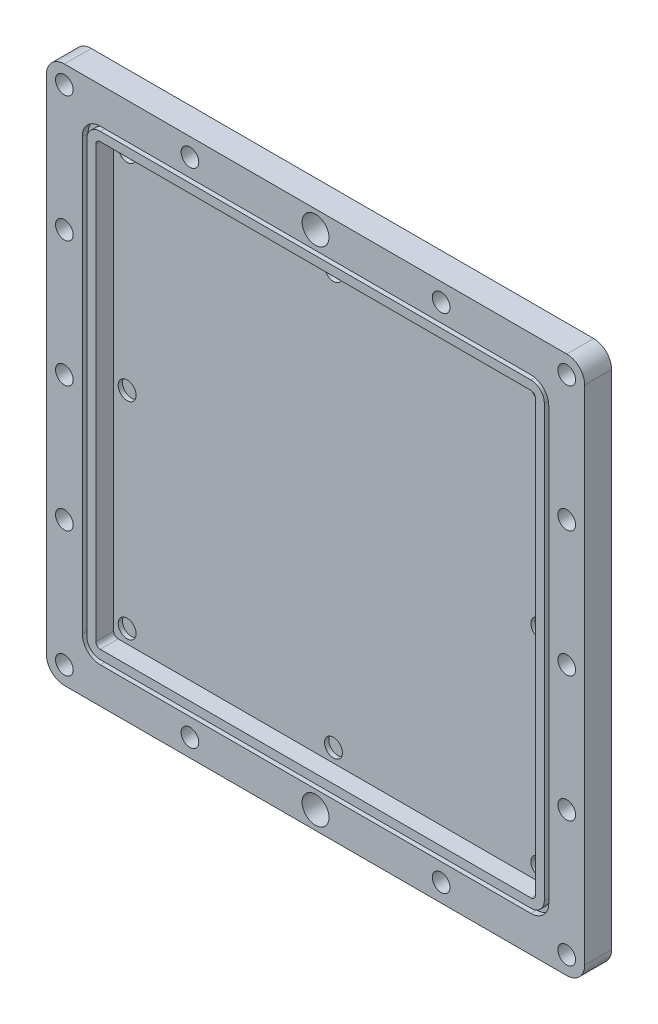
from build123d import *

# Parameters (mm, degrees)
SKETCH1_W           = 190.5
SKETCH1_H           = 190.5
BOSS_EXTRUDE1_DEPTH = 9.525
SKETCH4_R           = 3.1242
CUT_EXTRUDE1_DEPTH  = 270.576010849
CUT_EXTRUDE2_DEPTH  = 2.032
CUT_EXTRUDE3_DEPTH  = 6.35
SKETCH7_R           = 3.175
CUT_EXTRUDE4_DEPTH  = 1.524
LPATTERN1_COUNT     = 4
LPATTERN1_PITCH     = 44.45
LPATTERN2_COUNT     = 4
LPATTERN2_PITCH     = 44.45
SKETCH8_R           = 4.7625
CUT_EXTRUDE5_DEPTH  = 270.576010849
FILLET1_R           = 6.35


with BuildPart() as part:
    # Sketch1 → Boss-Extrude1 (new body)
    with BuildSketch(Plane.XY):
        with Locations((95.25, 95.25)):
            Rectangle(SKETCH1_W, SKETCH1_H)
    extrude(amount=BOSS_EXTRUDE1_DEPTH)

    # Sketch4 → Cut-Extrude1 (cut, through all)
    with BuildSketch(Plane.XY.offset(9.525)):
        with Locations((6.35, 6.35)):
            Circle(SKETCH4_R)
        with Locations((6.35, 184.15)):
            Circle(SKETCH4_R)
        with Locations((184.15, 184.15)):
            Circle(SKETCH4_R)
        with Locations((184.15, 6.35)):
            Circle(SKETCH4_R)
    cut_extrude1 = extrude(amount=-CUT_EXTRUDE1_DEPTH, mode=Mode.SUBTRACT)

    # Sketch5 → Cut-Extrude2 (cut)
    with BuildSketch(Plane.XY.offset(9.525)):
        with BuildLine():
            Line((19.05, 177.8), (171.45, 177.8))
            ThreePointArc((171.45, 177.8), (175.940128061, 175.940128061), (177.8, 171.45))
            Line((177.8, 171.45), (177.8, 19.05))
            ThreePointArc((177.8, 19.05), (175.940128061, 14.559871939), (171.45, 12.7))
            Line((171.45, 12.7), (19.05, 12.7))
            ThreePointArc((19.05, 12.7), (14.559871939, 14.559871939), (12.7, 19.05))
            Line((12.7, 19.05), (12.7, 171.45))
            ThreePointArc((12.7, 171.45), (14.559871939, 175.940128061), (19.05, 177.8))
        make_face()
        with BuildLine():
            ThreePointArc((171.45, 14.2875), (174.817596045, 15.682403955), (176.2125, 19.05))
            Line((176.2125, 19.05), (176.2125, 171.45))
            ThreePointArc((176.2125, 171.45), (174.817596045, 174.817596045), (171.45, 176.2125))
            Line((171.45, 176.2125), (19.05, 176.2125))
            ThreePointArc((19.05, 176.2125), (15.682403955, 174.817596045), (14.2875, 171.45))
            Line((14.2875, 171.45), (14.2875, 19.05))
            ThreePointArc((14.2875, 19.05), (15.682403955, 15.682403955), (19.05, 14.2875))
            Line((19.05, 14.2875), (171.45, 14.2875))
        make_face(mode=Mode.SUBTRACT)
    extrude(amount=-CUT_EXTRUDE2_DEPTH, mode=Mode.SUBTRACT)

    # Sketch6 → Cut-Extrude3 (cut)
    with BuildSketch(Plane.XY.offset(9.525)):
        with BuildLine():
            Line((173.0375, 19.05), (173.0375, 171.45))
            ThreePointArc((173.0375, 171.45), (172.572532015, 172.572532015), (171.45, 173.0375))
            Line((171.45, 173.0375), (19.05, 173.0375))
            ThreePointArc((19.05, 173.0375), (17.927467985, 172.572532015), (17.4625, 171.45))
            Line((17.4625, 171.45), (17.4625, 19.05))
            ThreePointArc((17.4625, 19.05), (17.927467985, 17.927467985), (19.05, 17.4625))
            Line((19.05, 17.4625), (171.45, 17.4625))
            ThreePointArc((171.45, 17.4625), (172.572532015, 17.927467985), (173.0375, 19.05))
        make_face()
    extrude(amount=-CUT_EXTRUDE3_DEPTH, mode=Mode.SUBTRACT)

    # Sketch7 → Cut-Extrude4 (cut)
    with BuildSketch(Plane.XY.offset(3.175)):
        with Locations((22.225, 168.275)):
            Circle(SKETCH7_R)
        with Locations((168.275, 168.275)):
            Circle(SKETCH7_R)
        with Locations((22.225, 22.225)):
            Circle(SKETCH7_R)
        with Locations((168.275, 22.225)):
            Circle(SKETCH7_R)
        with Locations((95.25, 168.275)):
            Circle(SKETCH7_R)
        with Locations((22.225, 95.25)):
            Circle(SKETCH7_R)
        with Locations((168.275, 95.25)):
            Circle(SKETCH7_R)
        with Locations((95.25, 22.225)):
            Circle(SKETCH7_R)
    extrude(amount=-CUT_EXTRUDE4_DEPTH, mode=Mode.SUBTRACT)

    # LPattern1: Cut-Extrude1 ×4
    with Locations(*[(0, -i * LPATTERN1_PITCH, 0) for i in range(1, LPATTERN1_COUNT)]):
        add(cut_extrude1, mode=Mode.SUBTRACT)

    # LPattern2: Cut-Extrude1 ×4
    with Locations(*[(i * LPATTERN2_PITCH, 0, 0) for i in range(1, LPATTERN2_COUNT)]):
        add(cut_extrude1, mode=Mode.SUBTRACT)

    # Sketch8 → Cut-Extrude5 (cut, through all)
    with BuildSketch(Plane.XY.offset(9.525)):
        with Locations((95.25, 184.15)):
            Circle(SKETCH8_R)
        with Locations((95.25, 6.35)):
            Circle(SKETCH8_R)
    extrude(amount=-CUT_EXTRUDE5_DEPTH, mode=Mode.SUBTRACT)

    # Fillet1
    fillet1_edges = [part.edges().sort_by_distance(p)[0] for p in [
        (0, 190.5, 4.7625),
        (190.5, 190.5, 4.7625),
        (190.5, 0, 4.7625),
        (0, 0, 4.7625),
    ]]
    fillet(fillet1_edges, radius=FILLET1_R)


solid = part.part
